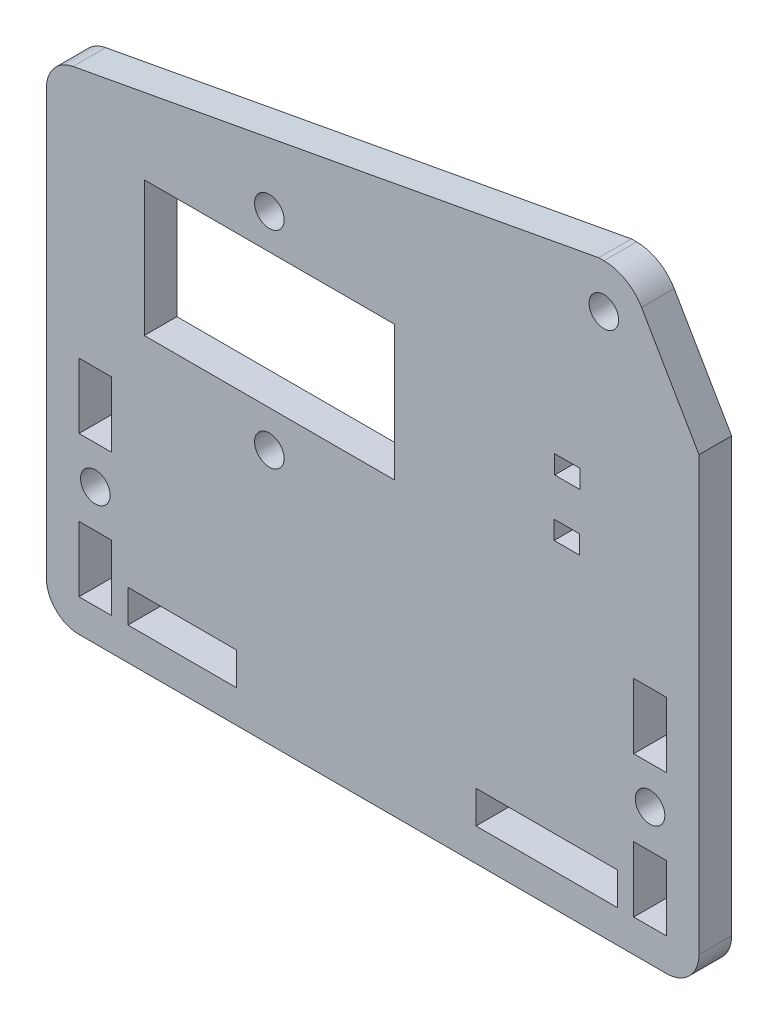
from build123d import *

# Parameters (mm, degrees)
SKETCH_1_R      = 1.359
SKETCH_1_W      = 2.329
SKETCH_1_H      = 1.693
SKETCH_1_W_2    = 12.999
SKETCH_1_H_2    = 3
SKETCH_1_W_3    = 10
SKETCH_1_W_4    = 3
SKETCH_1_H_3    = 6.001
SKETCH_1_W_5    = 23
SKETCH_1_H_4    = 12.399
EXTRUDE_1_DEPTH = 3


with BuildPart() as part:
    # 草图1 → 凸台-拉伸1 (new body)
    with BuildSketch(Plane.XY.offset(3)):
        with BuildLine():
            Line((3, -27.964431369), (57, -27.964431369))
            ThreePointArc((57, -27.964431369), (59.121320344, -27.085751712), (60, -24.964431369))
            Line((60, -24.964431369), (60, 14.844527968))
            Line((60, 14.844527968), (54.721484389, 23.930621486))
            ThreePointArc((54.721484389, 23.930621486), (53.258114674, 25.388095235), (51.262778196, 25.921305316))
            Line((51.262778196, 25.921305316), (50.782638999, 25.921305316))
            Line((50.782638999, 25.921305316), (2.454554127, 16.985586191))
            ThreePointArc((2.454554127, 16.985586191), (0.693884476, 15.954397926), (0, 14.035588089))
            Line((0, 14.035588089), (0, -24.964431369))
            ThreePointArc((0, -24.964431369), (0.878679656, -27.085751712), (3, -27.964431369))
        make_face()
        with Locations(Location((51.251, 21.869668631, 0), (0, 0, 180))):
            Circle(SKETCH_1_R, mode=Mode.SUBTRACT)
        with Locations(Location((20.499, 14.465668631, 0), (0, 0, 180))):
            Circle(SKETCH_1_R, mode=Mode.SUBTRACT)
        with Locations(Location((20.499, -4.535331369, 0), (0, 0, 180))):
            Circle(SKETCH_1_R, mode=Mode.SUBTRACT)
        with Locations(Location((4.5, -15.464331369, 0), (0, 0, 180))):
            Circle(SKETCH_1_R, mode=Mode.SUBTRACT)
        with Locations(Location((55.5, -15.464331369, 0), (0, 0, 180))):
            Circle(SKETCH_1_R, mode=Mode.SUBTRACT)
        with Locations((47.8435, 2.205168631)):
            Rectangle(SKETCH_1_W, SKETCH_1_H, mode=Mode.SUBTRACT)
        with Locations((47.8955, 7.444168631)):
            Rectangle(SKETCH_1_W, SKETCH_1_H, mode=Mode.SUBTRACT)
        with Locations((45.9995, -23.464331369)):
            Rectangle(SKETCH_1_W_2, SKETCH_1_H_2, mode=Mode.SUBTRACT)
        with Locations((12.5, -23.464331369)):
            Rectangle(SKETCH_1_W_3, SKETCH_1_H_2, mode=Mode.SUBTRACT)
        with Locations((55.5, -8.964831369)):
            Rectangle(SKETCH_1_W_4, SKETCH_1_H_3, mode=Mode.SUBTRACT)
        with Locations((55.5, -21.963831369)):
            Rectangle(SKETCH_1_W_4, SKETCH_1_H_3, mode=Mode.SUBTRACT)
        with Locations((4.501, -21.963831369)):
            Rectangle(SKETCH_1_W_4, SKETCH_1_H_3, mode=Mode.SUBTRACT)
        with Locations((4.501, -8.964831369)):
            Rectangle(SKETCH_1_W_4, SKETCH_1_H_3, mode=Mode.SUBTRACT)
        with Locations((20.5, 5.035168631)):
            Rectangle(SKETCH_1_W_5, SKETCH_1_H_4, mode=Mode.SUBTRACT)
    extrude(amount=-EXTRUDE_1_DEPTH)


solid = part.part
